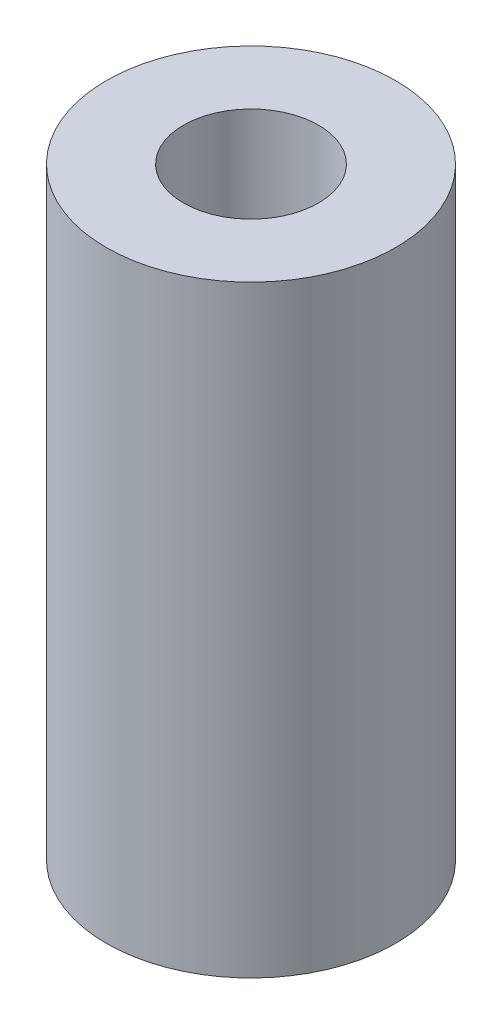
from build123d import *

# Parameters (mm, degrees)
SKETCH1_R           = 3
BOSS_EXTRUDE1_DEPTH = 12.5
SKETCH2_R           = 1.4
CUT_EXTRUDE1_DEPTH  = 10


with BuildPart() as part:
    # Sketch1 → Boss-Extrude1 (new body)
    with BuildSketch(Plane(origin=(0, 0, 0), x_dir=(1, 0, 0), z_dir=(0, 1, 0))):
        with Locations((112.753926627, -14.958146874)):
            Circle(SKETCH1_R)
    extrude(amount=BOSS_EXTRUDE1_DEPTH)

    # Sketch2 → Cut-Extrude1 (cut)
    with BuildSketch(Plane(origin=(0, 12.5, 0), x_dir=(1, 0, 0), z_dir=(0, 1, 0))):
        with Locations((112.753926627, -14.958146874)):
            Circle(SKETCH2_R)
    extrude(amount=-CUT_EXTRUDE1_DEPTH, mode=Mode.SUBTRACT)


solid = part.part
